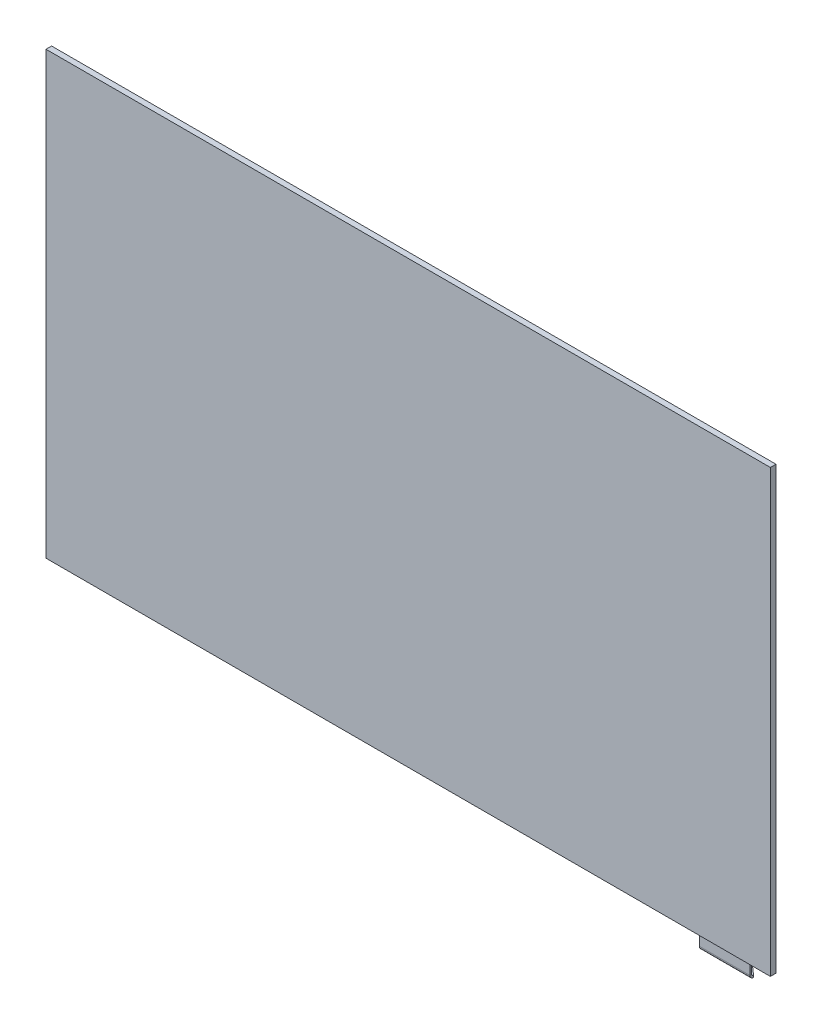
from build123d import *

# Parameters (mm, degrees)
SKETCH1_W           = 204.7875
SKETCH1_H           = 124.61875
BOSS_EXTRUDE1_DEPTH = 1.5875
EXTRUDE_THIN1_DEPTH = 14.2875
CUT_EXTRUDE1_DEPTH  = 165.658404983


with BuildPart() as part:
    # Sketch1 → Boss-Extrude1 (new body)
    with BuildSketch(Plane.XY):
        Rectangle(SKETCH1_W, SKETCH1_H)
    extrude(amount=BOSS_EXTRUDE1_DEPTH)

    # Sketch2 → Extrude-Thin1 (add)
    with BuildSketch(Plane(origin=(96.04375, 0, 0), x_dir=(0, 0, -1), z_dir=(1, 0, 0))):
        with BuildLine():
            Line((-1.04775, -62.309375), (-1.04775, -65.484375))
            ThreePointArc((-1.04775, -65.484375), (-0.74087113, -66.22524613), (0, -66.532125))
            Line((0, -66.532125), (4.22275, -66.532125))
            ThreePointArc((4.22275, -66.532125), (4.96362113, -66.22524613), (5.2705, -65.484375))
            Line((5.2705, -65.484375), (5.2705, -27.384375))
            Line((5.2705, -27.384375), (4.7625, -27.384375))
            Line((4.7625, -27.384375), (4.7625, -65.484375))
            ThreePointArc((4.7625, -65.484375), (4.604410885, -65.866035885), (4.22275, -66.024125))
            Line((4.22275, -66.024125), (0, -66.024125))
            ThreePointArc((0, -66.024125), (-0.381660885, -65.866035885), (-0.53975, -65.484375))
            Line((-0.53975, -65.484375), (-0.53975, -62.309375))
            Line((-0.53975, -62.309375), (-1.04775, -62.309375))
        make_face()
    extrude(amount=-EXTRUDE_THIN1_DEPTH)

    # Sketch3 → Cut-Extrude1 (cut, through all)
    with BuildSketch(Plane.XZ.offset(66.532125)):
        Polygon((81.75625, 0), (86.51875, -4.22275), (86.51875, -5.2705), (81.75625, -5.2705), align=None)
        Polygon((91.28125, -4.22275), (91.28125, -5.2705), (96.04375, -5.2705), (96.04375, 0), align=None)
    extrude(amount=-CUT_EXTRUDE1_DEPTH, mode=Mode.SUBTRACT)


solid = part.part
